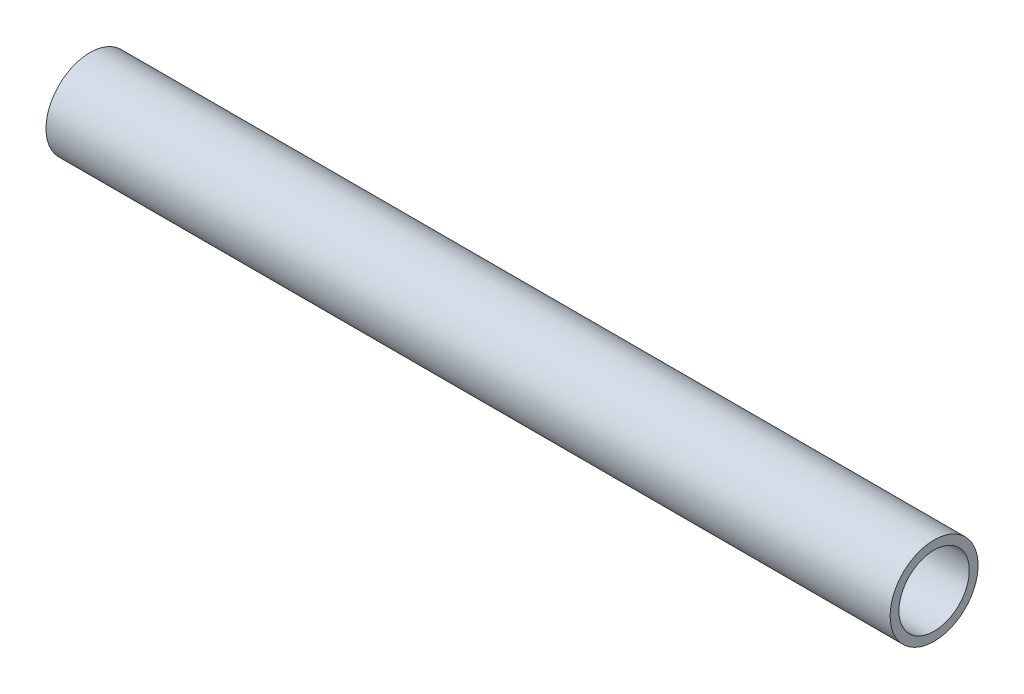
from build123d import *

# Parameters (mm, degrees)
SKETCH1_R      = 15.875
SKETCH1_R_2    = 12.7
EXTRUDE1_DEPTH = 152.4


with BuildPart() as part:
    # Sketch1 → Extrude1 (new, symmetric)
    with BuildSketch(Plane(origin=(0, 0, 0), x_dir=(0, 0, -1), z_dir=(1, 0, 0))):
        with Locations(Location((0, 0, 0), (0, 0, 180))):
            Circle(SKETCH1_R)
        with Locations(Location((0, 0, 0), (0, 0, 180))):
            Circle(SKETCH1_R_2, mode=Mode.SUBTRACT)
    extrude(amount=EXTRUDE1_DEPTH, both=True)


solid = part.part
